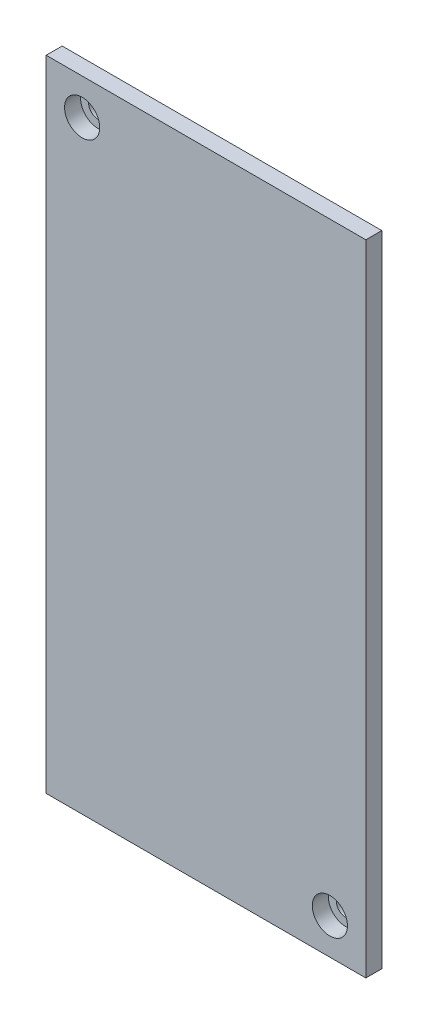
from build123d import *

# Parameters (mm, degrees)
ESQUISSE1_W             = 40
ESQUISSE1_H             = 80
BOSS_EXTRU_1_DEPTH      = 2
ESQUISSE1_3_W           = 35.6
ESQUISSE1_3_H           = 75.6
BOSS_EXTRU_2_DEPTH      = 1
ESQUISSE2_R             = 1.2
ENL_V_MAT_EXTRU_1_DEPTH = 45.821869662
ESQUISSE2_3_R           = 2.2
ESQUISSE2_3_R_2         = 1.2
ENL_V_MAT_EXTRU_2_DEPTH = 2


with BuildPart() as part:
    # Esquisse1 → Boss.-Extru.1 (new body)
    with BuildSketch(Plane.XY):
        Rectangle(ESQUISSE1_W, ESQUISSE1_H)
    extrude(amount=BOSS_EXTRU_1_DEPTH)

    # Esquisse1<3> → Boss.-Extru.2 (add)
    with BuildSketch(Plane.XY):
        Rectangle(ESQUISSE1_3_W, ESQUISSE1_3_H)
    extrude(amount=-BOSS_EXTRU_2_DEPTH)

    # Esquisse2 → Enlèv. mat.-Extru.1 (cut, through all)
    with BuildSketch(Plane.XY.offset(2)):
        with Locations((-15.5, 35.5)):
            Circle(ESQUISSE2_R)
        with Locations((15.5, -35.5)):
            Circle(ESQUISSE2_R)
    extrude(amount=-ENL_V_MAT_EXTRU_1_DEPTH, mode=Mode.SUBTRACT)

    # Esquisse2<3> → Enlèv. mat.-Extru.2 (cut)
    # profile 1 of 2: a face of its own
    with BuildSketch(Plane.XY.offset(2)):
        with Locations((-15.5, 35.5)):
            Circle(ESQUISSE2_3_R)
        with Locations((-15.5, 35.5)):
            Circle(ESQUISSE2_3_R_2, mode=Mode.SUBTRACT)
    # profile 2 of 2: a face of its own
    with BuildSketch(Plane.XY.offset(2)):
        with Locations((15.5, -35.5)):
            Circle(ESQUISSE2_3_R)
        with Locations((15.5, -35.5)):
            Circle(ESQUISSE2_3_R_2, mode=Mode.SUBTRACT)
    extrude(amount=-ENL_V_MAT_EXTRU_2_DEPTH, mode=Mode.SUBTRACT)


solid = part.part
